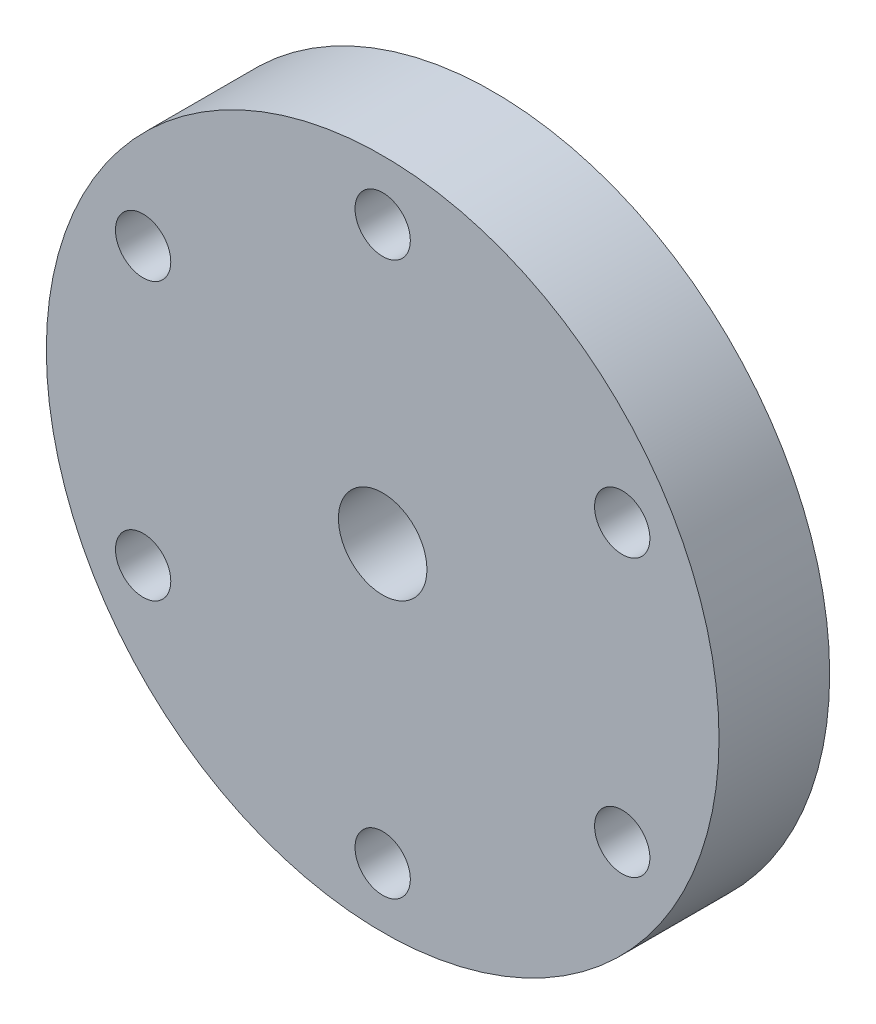
from build123d import *

# Parameters (mm, degrees)
SKETCH_1_R               = 15.2
EXTRUDE_2_DEPTH          = 5
CUT_EXTRUDE_1_DEPTH      = 23.069888989
CUT_EXTRUDE_1_DEPTH_BACK = 23.069888989
SKETCH_3_R               = 1.25
CUT_EXTRUDE_2_DEPTH      = 23.069888989
CUT_EXTRUDE_2_DEPTH_BACK = 23.069888989
SKETCH_4_R               = 2


with BuildPart() as part:
    # 草图1 → 凸台-拉伸2 (new body)
    with BuildSketch(Plane.XY):
        Circle(SKETCH_1_R)
    extrude(amount=EXTRUDE_2_DEPTH)

    # 草图3 → 切除-拉伸1 (cut, two sides: drawn at the far end of the back side and taken through both)
    with BuildSketch(Plane.XY.offset(5).offset(-CUT_EXTRUDE_1_DEPTH_BACK)):
        with Locations((0, 12.5)):
            Circle(SKETCH_3_R)
        with Locations((10.825317547, 6.25)):
            Circle(SKETCH_3_R)
        with Locations((10.825317547, -6.25)):
            Circle(SKETCH_3_R)
        with Locations((0, -12.5)):
            Circle(SKETCH_3_R)
        with Locations((-10.825317547, -6.25)):
            Circle(SKETCH_3_R)
        with Locations((-10.825317547, 6.25)):
            Circle(SKETCH_3_R)
    extrude(amount=CUT_EXTRUDE_1_DEPTH + CUT_EXTRUDE_1_DEPTH_BACK, mode=Mode.SUBTRACT)

    # 草图4 → 切除-拉伸2 (cut, two sides: drawn at the far end of the back side and taken through both)
    with BuildSketch(Plane.XY.offset(5).offset(-CUT_EXTRUDE_2_DEPTH_BACK)):
        Circle(SKETCH_4_R)
    extrude(amount=CUT_EXTRUDE_2_DEPTH + CUT_EXTRUDE_2_DEPTH_BACK, mode=Mode.SUBTRACT)


solid = part.part
